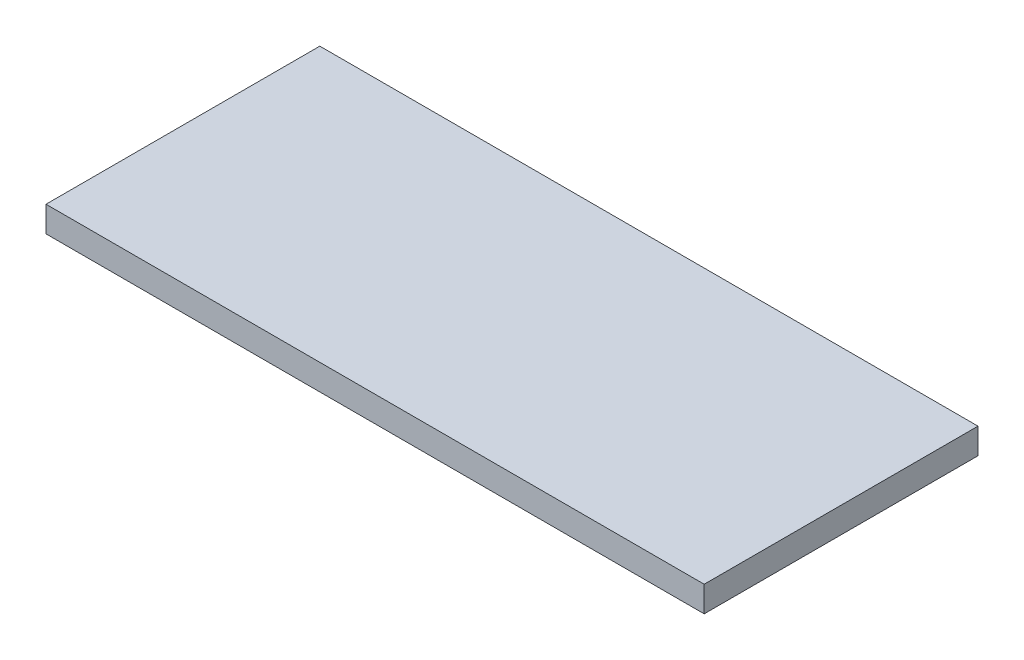
from build123d import *

# Parameters (mm, degrees)
SKETCH1_W           = 122.1105
SKETCH1_H           = 50.8
BOSS_EXTRUDE1_DEPTH = 4.7625


with BuildPart() as part:
    # Sketch1 → Boss-Extrude1 (new body)
    with BuildSketch(Plane(origin=(0, 0, 0), x_dir=(1, 0, 0), z_dir=(0, 1, 0))):
        with Locations((61.05525, 25.4)):
            Rectangle(SKETCH1_W, SKETCH1_H)
    extrude(amount=BOSS_EXTRUDE1_DEPTH)


solid = part.part
